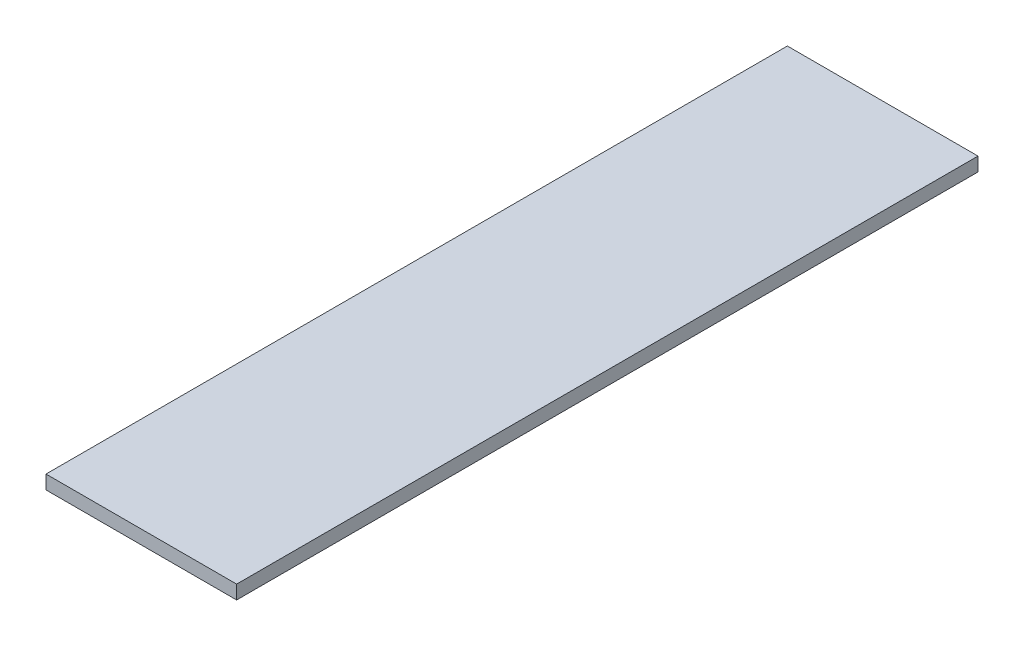
from build123d import *

# Parameters (mm, degrees)
SKETCH1_W           = 180
SKETCH1_H           = 13
BOSS_EXTRUDE1_DEPTH = 700


with BuildPart() as part:
    # Sketch1 → Boss-Extrude1 (new body)
    with BuildSketch(Plane.XY):
        with Locations((28.455803005, 22.312092224)):
            Rectangle(SKETCH1_W, SKETCH1_H)
    extrude(amount=BOSS_EXTRUDE1_DEPTH)


solid = part.part
